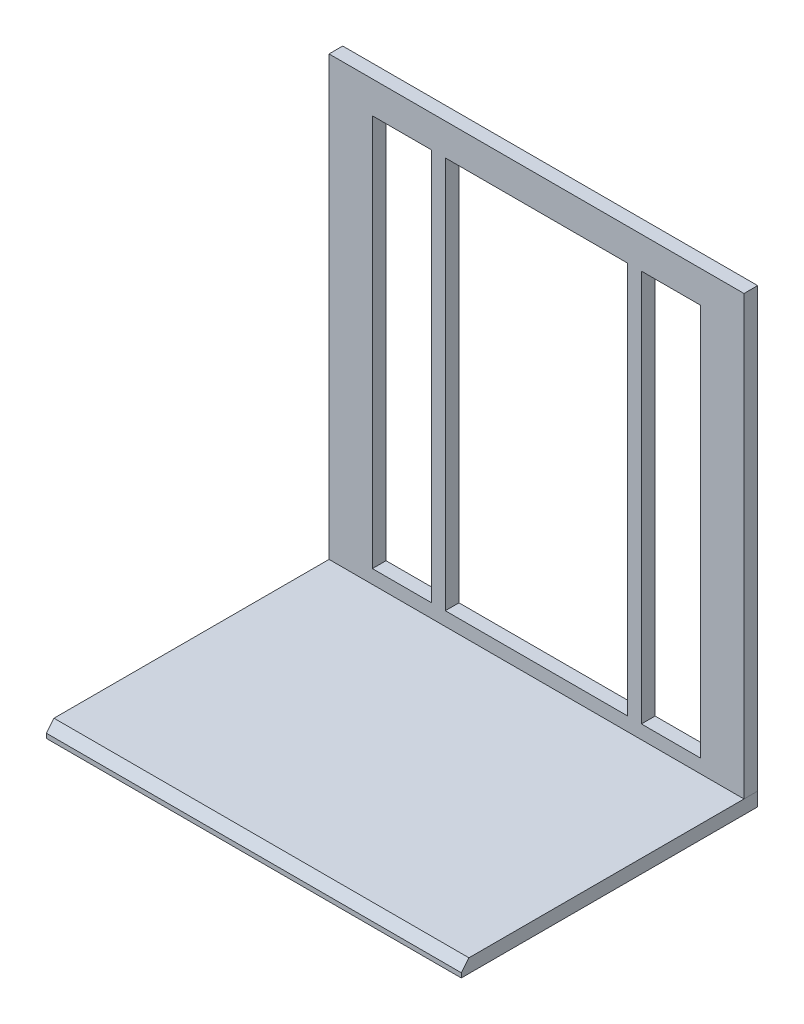
from build123d import *

# Parameters (mm, degrees)
SKETCH1_W           = 2311.4
SKETCH1_H           = 2438.4
SKETCH1_W_2         = 1016
SKETCH1_H_2         = 2184.4
SKETCH1_W_3         = 330.2
BOSS_EXTRUDE1_DEPTH = 76.2
SKETCH2_W           = 2311.4
SKETCH2_H           = 76.2
BOSS_EXTRUDE2_DEPTH = 1651
CHAMFER1_SIZE       = 50.8
CHAMFER1_SIZE2      = 42.626261264


with BuildPart() as part:
    # Sketch1 → Boss-Extrude1 (new body)
    with BuildSketch(Plane.XY):
        with Locations((0, 50.8)):
            Rectangle(SKETCH1_W, SKETCH1_H)
        Rectangle(SKETCH1_W_2, SKETCH1_H_2, mode=Mode.SUBTRACT)
        with Locations((-749.3, 0)):
            Rectangle(SKETCH1_W_3, SKETCH1_H_2, mode=Mode.SUBTRACT)
        with Locations((749.3, 0)):
            Rectangle(SKETCH1_W_3, SKETCH1_H_2, mode=Mode.SUBTRACT)
    extrude(amount=BOSS_EXTRUDE1_DEPTH)


with BuildPart() as body_2:
    # Sketch2 → Boss-Extrude2 (new body)
    with BuildSketch(Plane(origin=(0, 0, 0), x_dir=(-1, 0, 0), z_dir=(0, 0, -1))):
        with Locations((0, -1206.5)):
            Rectangle(SKETCH2_W, SKETCH2_H)
    extrude(amount=-BOSS_EXTRUDE2_DEPTH)

    # Chamfer1
    chamfer1_edges = [body_2.edges().sort_by_distance(p)[0] for p in [
        (0, -1168.4, 1651),
    ]]
    chamfer1_side = [body_2.faces().sort_by_distance(p)[0] for p in [
        (0, -1206.5, 1651),
    ]]
    chamfer(chamfer1_edges, length=CHAMFER1_SIZE, length2=CHAMFER1_SIZE2, reference=chamfer1_side[0])


solid = Compound([part.part, body_2.part])
